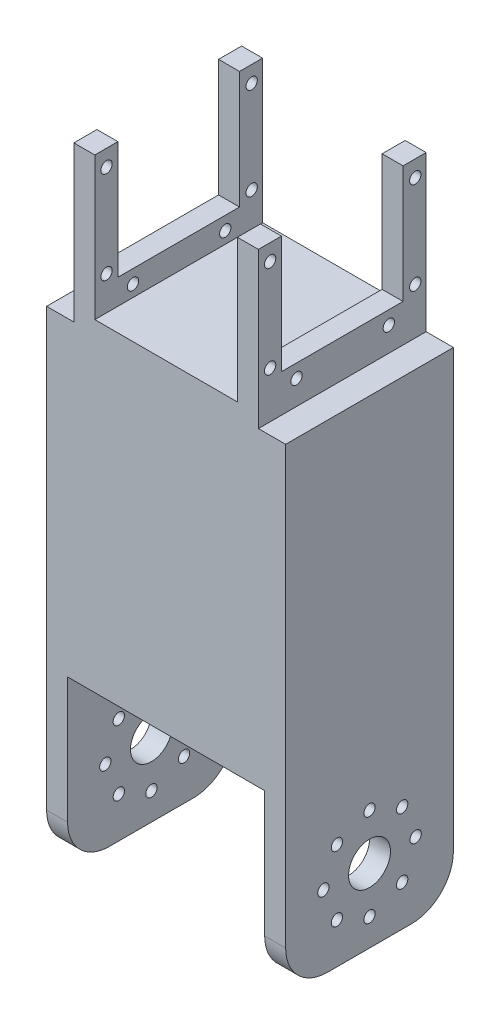
from build123d import *

# Parameters (mm, degrees)
SKETCH2_W           = 34
SKETCH2_H           = 40
BOSS_EXTRUDE1_DEPTH = 3
SKETCH3_W           = 5
SKETCH3_H           = 40
BOSS_EXTRUDE2_DEPTH = 37
CUT_EXTRUDE1_REACH  = 72.036
SKETCH4_R           = 1.35
SKETCH4_W           = 29
SKETCH4_H           = 28
SKETCH5_W           = 57
SKETCH5_H           = 40
BOSS_EXTRUDE3_DEPTH = 3
SKETCH6_W           = 57
SKETCH6_H           = 40
SKETCH6_W_2         = 51
SKETCH6_H_2         = 34
BOSS_EXTRUDE4_DEPTH = 68.03
SKETCH7_W           = 57
SKETCH7_H           = 40
BOSS_EXTRUDE5_DEPTH = 3
SKETCH8_W           = 5
SKETCH8_H           = 40
BOSS_EXTRUDE6_DEPTH = 40
CUT_EXTRUDE2_REACH  = 135.611
SKETCH9_R           = 5
SKETCH9_R_2         = 1.35


with BuildPart() as part:
    # Sketch2 → Boss-Extrude1 (new body)
    with BuildSketch(Plane(origin=(0, 0, 0), x_dir=(1, 0, 0), z_dir=(0, 1, 0))):
        with Locations((17, 20)):
            Rectangle(SKETCH2_W, SKETCH2_H)
    extrude(amount=BOSS_EXTRUDE1_DEPTH)

    # Sketch3 → Boss-Extrude2 (add)
    with BuildSketch(Plane(origin=(0, 0, 0), x_dir=(1, 0, 0), z_dir=(0, 1, 0))):
        with Locations((-2.5, 20)):
            Rectangle(SKETCH3_W, SKETCH3_H)
        with Locations((36.5, 20)):
            Rectangle(SKETCH3_W, SKETCH3_H)
    extrude(amount=BOSS_EXTRUDE2_DEPTH)

    # Cut-Extrude1: up to this face of the body (flat: up to its plane)
    cut_extrude1_end = Plane(part.part.faces().sort_by_distance((39, 18.5, -20))[0])
    # Sketch4 → Cut-Extrude1 (cut, up to the picked face)
    with BuildSketch(Plane.ZY.offset(5), mode=Mode.PRIVATE) as cut_extrude1_sk1:
        with Locations((-2.8, 33.1)):
            Circle(SKETCH4_R)
    cut_extrude1_tool1 = split(extrude(cut_extrude1_sk1.sketch, amount=-CUT_EXTRUDE1_REACH, mode=Mode.PRIVATE), bisect_by=cut_extrude1_end, keep=Keep.BOTH, mode=Mode.PRIVATE)
    # Sketch4 → Cut-Extrude1 (cut, up to the picked face)
    with BuildSketch(Plane.ZY.offset(5), mode=Mode.PRIVATE) as cut_extrude1_sk2:
        with Locations((-2.8, 11.1)):
            Circle(SKETCH4_R)
    cut_extrude1_tool2 = split(extrude(cut_extrude1_sk2.sketch, amount=-CUT_EXTRUDE1_REACH, mode=Mode.PRIVATE), bisect_by=cut_extrude1_end, keep=Keep.BOTH, mode=Mode.PRIVATE)
    # Sketch4 → Cut-Extrude1 (cut, up to the picked face)
    with BuildSketch(Plane.ZY.offset(5), mode=Mode.PRIVATE) as cut_extrude1_sk3:
        with Locations((-9.1, 5.8)):
            Circle(SKETCH4_R)
    cut_extrude1_tool3 = split(extrude(cut_extrude1_sk3.sketch, amount=-CUT_EXTRUDE1_REACH, mode=Mode.PRIVATE), bisect_by=cut_extrude1_end, keep=Keep.BOTH, mode=Mode.PRIVATE)
    # Sketch4 → Cut-Extrude1 (cut, up to the picked face)
    with BuildSketch(Plane.ZY.offset(5), mode=Mode.PRIVATE) as cut_extrude1_sk4:
        with Locations((-37.4, 11.1)):
            Circle(SKETCH4_R)
    cut_extrude1_tool4 = split(extrude(cut_extrude1_sk4.sketch, amount=-CUT_EXTRUDE1_REACH, mode=Mode.PRIVATE), bisect_by=cut_extrude1_end, keep=Keep.BOTH, mode=Mode.PRIVATE)
    # Sketch4 → Cut-Extrude1 (cut, up to the picked face)
    with BuildSketch(Plane.ZY.offset(5), mode=Mode.PRIVATE) as cut_extrude1_sk5:
        with Locations((-31.1, 5.8)):
            Circle(SKETCH4_R)
    cut_extrude1_tool5 = split(extrude(cut_extrude1_sk5.sketch, amount=-CUT_EXTRUDE1_REACH, mode=Mode.PRIVATE), bisect_by=cut_extrude1_end, keep=Keep.BOTH, mode=Mode.PRIVATE)
    # Sketch4 → Cut-Extrude1 (cut, up to the picked face)
    with BuildSketch(Plane.ZY.offset(5), mode=Mode.PRIVATE) as cut_extrude1_sk6:
        with Locations((-37.4, 33.1)):
            Circle(SKETCH4_R)
    cut_extrude1_tool6 = split(extrude(cut_extrude1_sk6.sketch, amount=-CUT_EXTRUDE1_REACH, mode=Mode.PRIVATE), bisect_by=cut_extrude1_end, keep=Keep.BOTH, mode=Mode.PRIVATE)
    # Sketch4 → Cut-Extrude1 (cut, up to the picked face)
    with BuildSketch(Plane.ZY.offset(5), mode=Mode.PRIVATE) as cut_extrude1_sk7:
        with Locations((-20, 23)):
            Rectangle(SKETCH4_W, SKETCH4_H)
    cut_extrude1_tool7 = split(extrude(cut_extrude1_sk7.sketch, amount=-CUT_EXTRUDE1_REACH, mode=Mode.PRIVATE), bisect_by=cut_extrude1_end, keep=Keep.BOTH, mode=Mode.PRIVATE)
    add(cut_extrude1_tool1.solids().sort_by(Axis((-5, 33.1, -2.8), (1, 0, 0)))[0], mode=Mode.SUBTRACT)
    add(cut_extrude1_tool2.solids().sort_by(Axis((-5, 11.1, -2.8), (1, 0, 0)))[0], mode=Mode.SUBTRACT)
    add(cut_extrude1_tool3.solids().sort_by(Axis((-5, 5.8, -9.1), (1, 0, 0)))[0], mode=Mode.SUBTRACT)
    add(cut_extrude1_tool4.solids().sort_by(Axis((-5, 11.1, -37.4), (1, 0, 0)))[0], mode=Mode.SUBTRACT)
    add(cut_extrude1_tool5.solids().sort_by(Axis((-5, 5.8, -31.1), (1, 0, 0)))[0], mode=Mode.SUBTRACT)
    add(cut_extrude1_tool6.solids().sort_by(Axis((-5, 33.1, -37.4), (1, 0, 0)))[0], mode=Mode.SUBTRACT)
    add(cut_extrude1_tool7.solids().sort_by(Axis((-5, 23, -20), (1, 0, 0)))[0], mode=Mode.SUBTRACT)

    # Sketch5 → Boss-Extrude3 (add)
    with BuildSketch(Plane(origin=(0, 0, 0), x_dir=(-1, 0, 0), z_dir=(0, -1, 0))):
        with Locations((-17, 20)):
            Rectangle(SKETCH5_W, SKETCH5_H)
    extrude(amount=BOSS_EXTRUDE3_DEPTH)

    # Sketch6 → Boss-Extrude4 (add)
    with BuildSketch(Plane.XZ.offset(3)):
        with Locations((17, -20)):
            Rectangle(SKETCH6_W, SKETCH6_H)
        with Locations((17, -20)):
            Rectangle(SKETCH6_W_2, SKETCH6_H_2, mode=Mode.SUBTRACT)
    extrude(amount=BOSS_EXTRUDE4_DEPTH)

    # Sketch7 → Boss-Extrude5 (add)
    with BuildSketch(Plane.XZ.offset(71.03)):
        with Locations((17, -20)):
            Rectangle(SKETCH7_W, SKETCH7_H)
    extrude(amount=BOSS_EXTRUDE5_DEPTH)

    # Sketch8 → Boss-Extrude6 (add)
    with BuildSketch(Plane.XZ.offset(74.03)):
        with Locations((-9, -20)):
            Rectangle(SKETCH8_W, SKETCH8_H)
        with Locations((43, -20)):
            Rectangle(SKETCH8_W, SKETCH8_H)
    extrude(amount=BOSS_EXTRUDE6_DEPTH)

    # Cut-Extrude2: up to this face of the body (flat: up to its plane)
    cut_extrude2_end = Plane(part.part.faces().sort_by_distance((-11.5, -57.015, -20))[0])
    # Sketch9 → Cut-Extrude2 (cut, up to the picked face)
    with BuildSketch(Plane(origin=(45.5, 0, 0), x_dir=(0, 0, -1), z_dir=(1, 0, 0)), mode=Mode.PRIVATE) as cut_extrude2_sk1:
        with BuildLine():
            ThreePointArc((40, -104.03), (37.071067812, -111.101067812), (30, -114.03))
            Line((30, -114.03), (40, -114.03))
            Line((40, -114.03), (40, -104.03))
        make_face()
    cut_extrude2_tool1 = split(extrude(cut_extrude2_sk1.sketch, amount=-CUT_EXTRUDE2_REACH, mode=Mode.PRIVATE), bisect_by=cut_extrude2_end, keep=Keep.BOTH, mode=Mode.PRIVATE)
    # Sketch9 → Cut-Extrude2 (cut, up to the picked face)
    with BuildSketch(Plane(origin=(45.5, 0, 0), x_dir=(0, 0, -1), z_dir=(1, 0, 0)), mode=Mode.PRIVATE) as cut_extrude2_sk2:
        with BuildLine():
            ThreePointArc((10, -114.03), (2.928932188, -111.101067812), (0, -104.03))
            Line((0, -104.03), (0, -114.03))
            Line((0, -114.03), (10, -114.03))
        make_face()
    cut_extrude2_tool2 = split(extrude(cut_extrude2_sk2.sketch, amount=-CUT_EXTRUDE2_REACH, mode=Mode.PRIVATE), bisect_by=cut_extrude2_end, keep=Keep.BOTH, mode=Mode.PRIVATE)
    # Sketch9 → Cut-Extrude2 (cut, up to the picked face)
    with BuildSketch(Plane(origin=(45.5, 0, 0), x_dir=(0, 0, -1), z_dir=(1, 0, 0)), mode=Mode.PRIVATE) as cut_extrude2_sk3:
        with Locations((20, -96.53)):
            Circle(SKETCH9_R)
    cut_extrude2_tool3 = split(extrude(cut_extrude2_sk3.sketch, amount=-CUT_EXTRUDE2_REACH, mode=Mode.PRIVATE), bisect_by=cut_extrude2_end, keep=Keep.BOTH, mode=Mode.PRIVATE)
    # Sketch9 → Cut-Extrude2 (cut, up to the picked face)
    with BuildSketch(Plane(origin=(45.5, 0, 0), x_dir=(0, 0, -1), z_dir=(1, 0, 0)), mode=Mode.PRIVATE) as cut_extrude2_sk4:
        with Locations((27.778174593, -104.308174593)):
            Circle(SKETCH9_R_2)
    cut_extrude2_tool4 = split(extrude(cut_extrude2_sk4.sketch, amount=-CUT_EXTRUDE2_REACH, mode=Mode.PRIVATE), bisect_by=cut_extrude2_end, keep=Keep.BOTH, mode=Mode.PRIVATE)
    # Sketch9 → Cut-Extrude2 (cut, up to the picked face)
    with BuildSketch(Plane(origin=(45.5, 0, 0), x_dir=(0, 0, -1), z_dir=(1, 0, 0)), mode=Mode.PRIVATE) as cut_extrude2_sk5:
        with Locations((20, -107.53)):
            Circle(SKETCH9_R_2)
    cut_extrude2_tool5 = split(extrude(cut_extrude2_sk5.sketch, amount=-CUT_EXTRUDE2_REACH, mode=Mode.PRIVATE), bisect_by=cut_extrude2_end, keep=Keep.BOTH, mode=Mode.PRIVATE)
    # Sketch9 → Cut-Extrude2 (cut, up to the picked face)
    with BuildSketch(Plane(origin=(45.5, 0, 0), x_dir=(0, 0, -1), z_dir=(1, 0, 0)), mode=Mode.PRIVATE) as cut_extrude2_sk6:
        with Locations((12.221825407, -104.308174593)):
            Circle(SKETCH9_R_2)
    cut_extrude2_tool6 = split(extrude(cut_extrude2_sk6.sketch, amount=-CUT_EXTRUDE2_REACH, mode=Mode.PRIVATE), bisect_by=cut_extrude2_end, keep=Keep.BOTH, mode=Mode.PRIVATE)
    # Sketch9 → Cut-Extrude2 (cut, up to the picked face)
    with BuildSketch(Plane(origin=(45.5, 0, 0), x_dir=(0, 0, -1), z_dir=(1, 0, 0)), mode=Mode.PRIVATE) as cut_extrude2_sk7:
        with Locations((31, -96.53)):
            Circle(SKETCH9_R_2)
    cut_extrude2_tool7 = split(extrude(cut_extrude2_sk7.sketch, amount=-CUT_EXTRUDE2_REACH, mode=Mode.PRIVATE), bisect_by=cut_extrude2_end, keep=Keep.BOTH, mode=Mode.PRIVATE)
    # Sketch9 → Cut-Extrude2 (cut, up to the picked face)
    with BuildSketch(Plane(origin=(45.5, 0, 0), x_dir=(0, 0, -1), z_dir=(1, 0, 0)), mode=Mode.PRIVATE) as cut_extrude2_sk8:
        with Locations((27.778174593, -88.751825407)):
            Circle(SKETCH9_R_2)
    cut_extrude2_tool8 = split(extrude(cut_extrude2_sk8.sketch, amount=-CUT_EXTRUDE2_REACH, mode=Mode.PRIVATE), bisect_by=cut_extrude2_end, keep=Keep.BOTH, mode=Mode.PRIVATE)
    # Sketch9 → Cut-Extrude2 (cut, up to the picked face)
    with BuildSketch(Plane(origin=(45.5, 0, 0), x_dir=(0, 0, -1), z_dir=(1, 0, 0)), mode=Mode.PRIVATE) as cut_extrude2_sk9:
        with Locations((20, -85.53)):
            Circle(SKETCH9_R_2)
    cut_extrude2_tool9 = split(extrude(cut_extrude2_sk9.sketch, amount=-CUT_EXTRUDE2_REACH, mode=Mode.PRIVATE), bisect_by=cut_extrude2_end, keep=Keep.BOTH, mode=Mode.PRIVATE)
    # Sketch9 → Cut-Extrude2 (cut, up to the picked face)
    with BuildSketch(Plane(origin=(45.5, 0, 0), x_dir=(0, 0, -1), z_dir=(1, 0, 0)), mode=Mode.PRIVATE) as cut_extrude2_sk10:
        with Locations((12.221825407, -88.751825407)):
            Circle(SKETCH9_R_2)
    cut_extrude2_tool10 = split(extrude(cut_extrude2_sk10.sketch, amount=-CUT_EXTRUDE2_REACH, mode=Mode.PRIVATE), bisect_by=cut_extrude2_end, keep=Keep.BOTH, mode=Mode.PRIVATE)
    # Sketch9 → Cut-Extrude2 (cut, up to the picked face)
    with BuildSketch(Plane(origin=(45.5, 0, 0), x_dir=(0, 0, -1), z_dir=(1, 0, 0)), mode=Mode.PRIVATE) as cut_extrude2_sk11:
        with Locations((9, -96.53)):
            Circle(SKETCH9_R_2)
    cut_extrude2_tool11 = split(extrude(cut_extrude2_sk11.sketch, amount=-CUT_EXTRUDE2_REACH, mode=Mode.PRIVATE), bisect_by=cut_extrude2_end, keep=Keep.BOTH, mode=Mode.PRIVATE)
    add(cut_extrude2_tool1.solids().sort_by(Axis((45.5, -111.796321, -37.766321), (-1, 0, 0)))[0], mode=Mode.SUBTRACT)
    add(cut_extrude2_tool2.solids().sort_by(Axis((45.5, -111.796321, -2.233679), (-1, 0, 0)))[0], mode=Mode.SUBTRACT)
    add(cut_extrude2_tool3.solids().sort_by(Axis((45.5, -96.53, -20), (-1, 0, 0)))[0], mode=Mode.SUBTRACT)
    add(cut_extrude2_tool4.solids().sort_by(Axis((45.5, -104.308175, -27.778175), (-1, 0, 0)))[0], mode=Mode.SUBTRACT)
    add(cut_extrude2_tool5.solids().sort_by(Axis((45.5, -107.53, -20), (-1, 0, 0)))[0], mode=Mode.SUBTRACT)
    add(cut_extrude2_tool6.solids().sort_by(Axis((45.5, -104.308175, -12.221825), (-1, 0, 0)))[0], mode=Mode.SUBTRACT)
    add(cut_extrude2_tool7.solids().sort_by(Axis((45.5, -96.53, -31), (-1, 0, 0)))[0], mode=Mode.SUBTRACT)
    add(cut_extrude2_tool8.solids().sort_by(Axis((45.5, -88.751825, -27.778175), (-1, 0, 0)))[0], mode=Mode.SUBTRACT)
    add(cut_extrude2_tool9.solids().sort_by(Axis((45.5, -85.53, -20), (-1, 0, 0)))[0], mode=Mode.SUBTRACT)
    add(cut_extrude2_tool10.solids().sort_by(Axis((45.5, -88.751825, -12.221825), (-1, 0, 0)))[0], mode=Mode.SUBTRACT)
    add(cut_extrude2_tool11.solids().sort_by(Axis((45.5, -96.53, -9), (-1, 0, 0)))[0], mode=Mode.SUBTRACT)


solid = part.part
